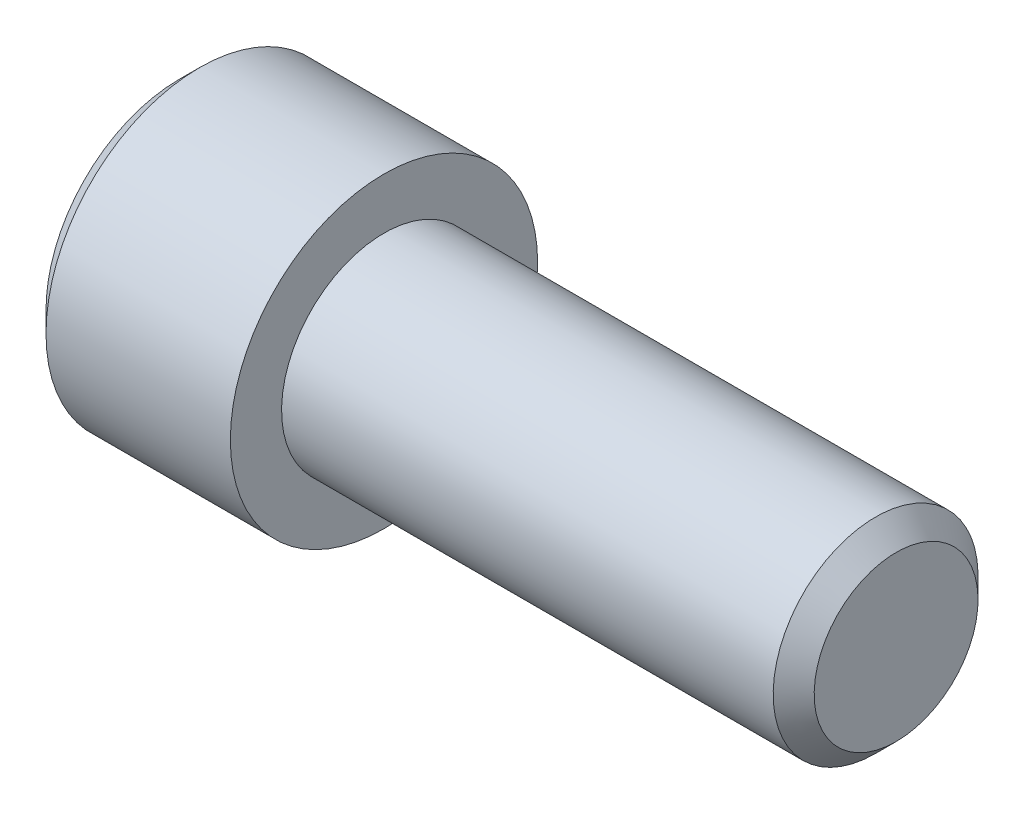
from build123d import *

# Parameters (mm, degrees)
CUT_EXTRUDE1_DEPTH = 6
CHAMFER1_SIZE      = 1.2


with BuildPart() as part:
    # Sketch1 → Revolve1 (revolve)
    with BuildSketch(Plane.XY, mode=Mode.PRIVATE) as revolve1_sk:
        Polygon((-12, 0), (-12, 9), (0, 9), (0, 6), (30, 6), (30, 0), align=None)
    revolve(revolve1_sk.sketch.rotate(Axis((30, 0, 0), (-1, 0, 0)), 180), axis=Axis((30, 0, 0), (-1, 0, 0)))

    # Sketch2 → Cut-Revolve1 (revolve, cut)
    with BuildSketch(Plane.XY, mode=Mode.PRIVATE) as cut_revolve1_sk:
        Polygon((-12, 0), (-12, 4.995), (-6, 4.995), (-4.661593784, 0), align=None)
    revolve(cut_revolve1_sk.sketch.rotate(Axis((-4.661593784, 0, 0), (-1, 0, 0)), 270), axis=Axis((-4.661593784, 0, 0), (-1, 0, 0)), mode=Mode.SUBTRACT)

    # Sketch3 → Cut-Extrude1 (cut)
    with BuildSketch(Plane.ZY.offset(12)):
        Polygon((0, -5.773502692), (5, -2.886751346), (5, 2.886751346), (0, 5.773502692), (-5, 2.886751346), (-5, -2.886751346), align=None)
    extrude(amount=-CUT_EXTRUDE1_DEPTH, mode=Mode.SUBTRACT)

    # Chamfer1
    chamfer1_edges = [part.edges().sort_by_distance(p)[0] for p in [
        (30, 6, 0),
        (-12, 9, 0),
    ]]
    chamfer(chamfer1_edges, length=CHAMFER1_SIZE)


solid = part.part
